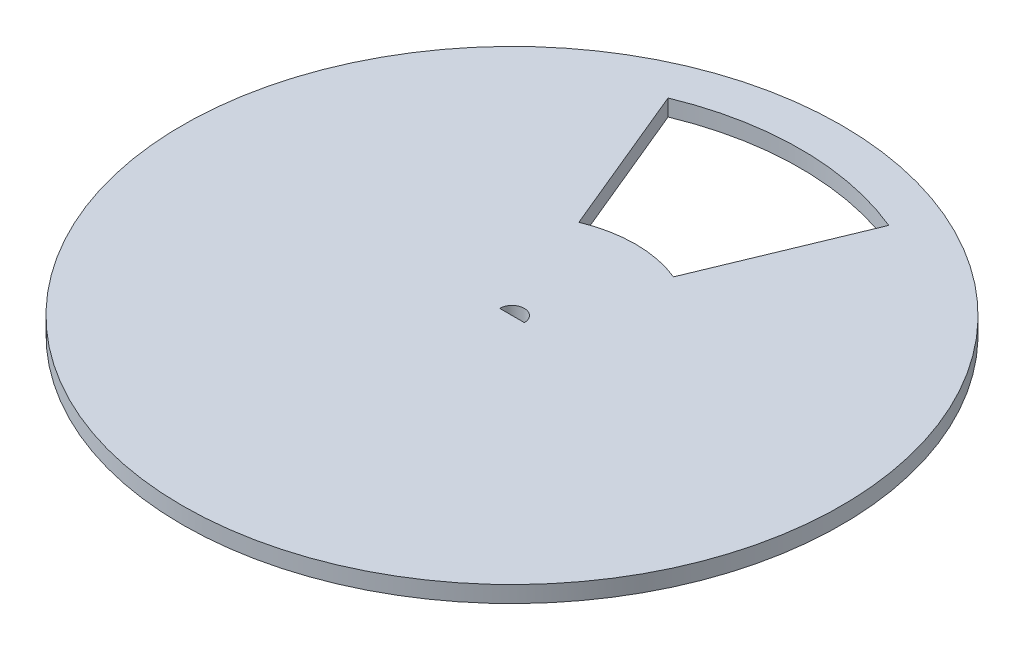
from build123d import *

# Parameters (mm, degrees)
SKETCH2_R           = 40
BOSS_EXTRUDE1_DEPTH = 2
CUT_EXTRUDE1_REACH  = 58.604
CUT_EXTRUDE2_DEPTH  = 57.603886792


with BuildPart() as part:
    # Sketch2 → Boss-Extrude1 (new body)
    with BuildSketch(Plane(origin=(0, 0, 0), x_dir=(1, 0, 0), z_dir=(0, 1, 0))):
        with Locations(Location((0, 0, 0), (0, 0, 270))):
            Circle(SKETCH2_R)
    extrude(amount=BOSS_EXTRUDE1_DEPTH)

    # Sketch3 → Cut-Extrude1 (cut, up to next)
    with BuildSketch(Plane(origin=(0, 2, 0), x_dir=(1, 0, 0), z_dir=(0, 1, 0)), mode=Mode.PRIVATE) as cut_extrude1_sk1:
        with BuildLine():
            Line((-5.740251485, 13.858192988), (-13.393920133, 32.335783638))
            ThreePointArc((-13.393920133, 32.335783638), (0, 35), (13.393920133, 32.335783638))
            Line((13.393920133, 32.335783638), (5.740251485, 13.858192988))
            ThreePointArc((5.740251485, 13.858192988), (0, 15), (-5.740251485, 13.858192988))
        make_face()
    cut_extrude1_tool1 = extrude(cut_extrude1_sk1.sketch, amount=-CUT_EXTRUDE1_REACH, mode=Mode.PRIVATE) & part.part
    add(cut_extrude1_tool1.solids().sort_by_distance((0, 2, -25.661711))[0], mode=Mode.SUBTRACT)

    # Sketch5 → Cut-Extrude2 (cut, through all)
    with BuildSketch(Plane(origin=(0, 2, 0), x_dir=(1, 0, 0), z_dir=(0, 1, 0))):
        with BuildLine():
            Line((-1.5, 0), (1.5, 0))
            ThreePointArc((1.5, 0), (0, 1.5), (-1.5, 0))
        make_face()
    extrude(amount=-CUT_EXTRUDE2_DEPTH, mode=Mode.SUBTRACT)


solid = part.part
